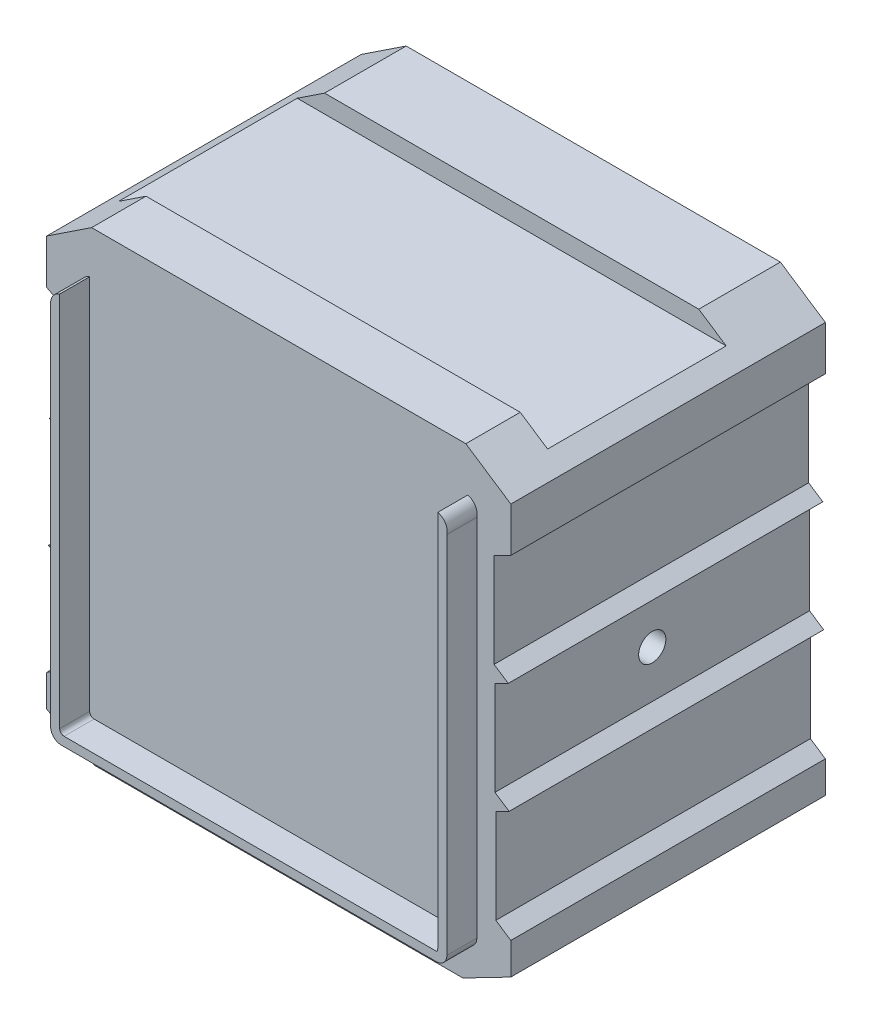
from build123d import *

# Parameters (mm, degrees)
BOSS_EXTRUDE1_DEPTH = 173.478
BOSS_EXTRUDE2_DEPTH = 16.522
SKETCH5_W           = 256
SKETCH5_H           = 98.478
CUT_EXTRUDE3_DEPTH  = 10
SKETCH7_R           = 7.5
CUT_EXTRUDE4_DEPTH  = 404.448315513


with BuildPart() as part:
    # Sketch1 → Boss-Extrude1 (new body)
    with BuildSketch(Plane.XY):
        Polygon((-103.1895488, 0), (103.1895488, 0), (128, -16.432610434), (128, -40.962966098), (118.774155672, -45.61934731), (118.774155672, -97.61934731), (126.583328469, -102.791566604), (119.25400561, -106.490753372), (119.25400561, -158.490753372), (127.063178407, -163.662972666), (119.733855548, -167.362159434), (119.733855548, -219.362159434), (128, -224.837043001), (128, -242.345271931), (101.558790198, -256), (-101.558790198, -256), (-128, -242.345271931), (-128, -224.837043001), (-119.733855548, -219.362159434), (-119.733855548, -167.362159434), (-127.063178407, -163.662972666), (-119.25400561, -158.490753372), (-119.25400561, -106.490753372), (-126.583328469, -102.791566604), (-118.774155672, -97.61934731), (-118.774155672, -45.61934731), (-128, -40.962966098), (-128, -16.432610434), align=None)
    extrude(amount=BOSS_EXTRUDE1_DEPTH)

    # Sketch3 → Boss-Extrude2 (add)
    with BuildSketch(Plane.XY.offset(173.478)):
        with BuildLine():
            Line((-109.25400561, -30.77642723), (-109.25400561, -233.134965715))
            ThreePointArc((-109.25400561, -233.134965715), (-107.53617684, -237.28217123), (-103.388971325, -239))
            Line((-103.388971325, -239), (103.388971325, -239))
            ThreePointArc((103.388971325, -239), (107.53617684, -237.28217123), (109.25400561, -233.134965715))
            Line((109.25400561, -233.134965715), (109.25400561, -32.174007784))
            ThreePointArc((109.25400561, -32.174007784), (108.447882002, -27.049094521), (104.25400561, -23.99524907))
            Line((104.25400561, -23.99524907), (104.25400561, -231.784495248))
            ThreePointArc((104.25400561, -231.784495248), (104.136715259, -232.916299233), (103.789829206, -234))
            Line((103.789829206, -234), (-101.829987525, -234))
            ThreePointArc((-101.829987525, -234), (-103.544027151, -233.290021541), (-104.25400561, -231.575981915))
            Line((-104.25400561, -231.575981915), (-104.25400561, -23.99524907))
            ThreePointArc((-104.25400561, -23.99524907), (-107.868861491, -26.563815889), (-109.25400561, -30.77642723))
        make_face()
    extrude(amount=BOSS_EXTRUDE2_DEPTH)

    # Sketch5 → Cut-Extrude3 (cut)
    with BuildSketch(Plane(origin=(0, 0, 0), x_dir=(1, 0, 0), z_dir=(0, 1, 0))):
        with Locations((0, -94.239)):
            Rectangle(SKETCH5_W, SKETCH5_H)
    extrude(amount=-CUT_EXTRUDE3_DEPTH, mode=Mode.SUBTRACT)

    # Sketch7 → Cut-Extrude4 (cut, through all)
    with BuildSketch(Plane(origin=(119.25400561, 0, 0), x_dir=(0, 0, -1), z_dir=(1, 0, 0))):
        with Locations(Location((-86.739, -132.490753372, 0), (0, 0, 90))):
            Circle(SKETCH7_R)
    extrude(amount=-CUT_EXTRUDE4_DEPTH, mode=Mode.SUBTRACT)


solid = part.part
